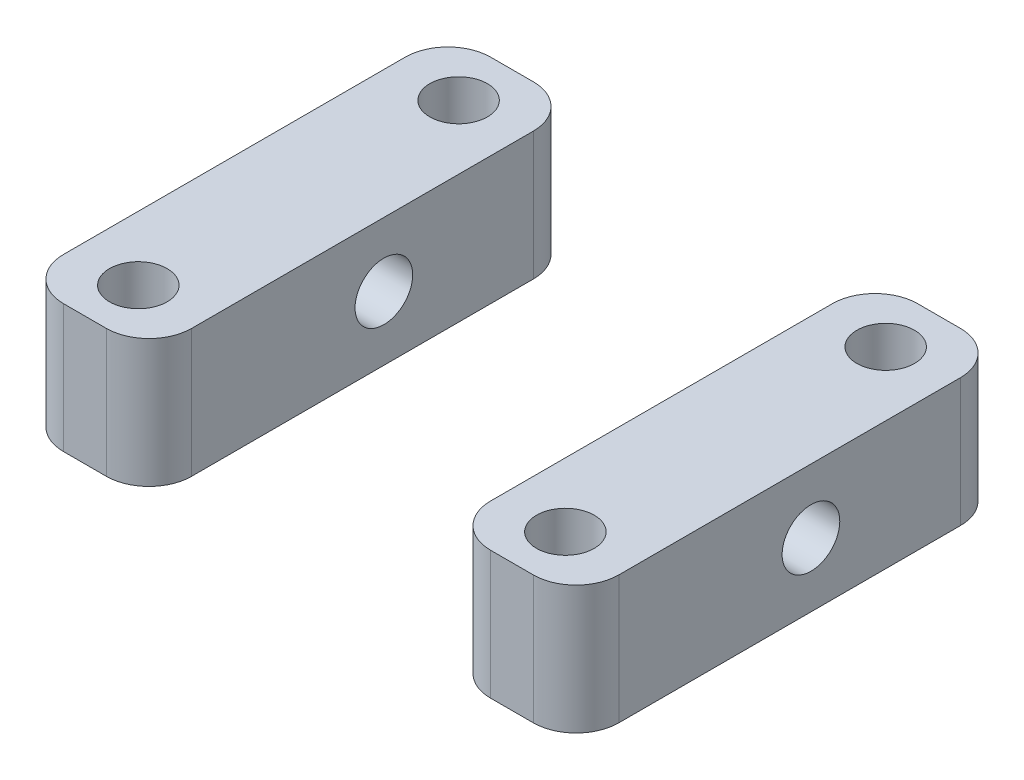
from build123d import *

# Parameters (mm, degrees)
SKETCH_1_W          = 26
SKETCH_1_H          = 20
SKETCH_1_R          = 1.35
EXTRUDE_1_DEPTH     = 6
SKETCH_2_W          = 14
SKETCH_2_H          = 20
CUT_EXTRUDE_1_DEPTH = 18.464249197
SKETCH_5_R          = 1.35
CUT_EXTRUDE_2_DEPTH = 29.495613698
FILLET_1_R          = 2
FILLET_2_R          = 2


with BuildPart() as part:
    # 草图1 → 凸台-拉伸1 (new body)
    with BuildSketch(Plane(origin=(0, 0, 0), x_dir=(1, 0, 0), z_dir=(0, 1, 0))):
        Rectangle(SKETCH_1_W, SKETCH_1_H)
        with Locations(Location((-10, 7.5, 0), (0, 0, 270))):
            Circle(SKETCH_1_R, mode=Mode.SUBTRACT)
        with Locations(Location((10, 7.5, 0), (0, 0, 90))):
            Circle(SKETCH_1_R, mode=Mode.SUBTRACT)
        with Locations(Location((10, -7.5, 0), (0, 0, 270))):
            Circle(SKETCH_1_R, mode=Mode.SUBTRACT)
        with Locations(Location((-10, -7.5, 0), (0, 0, 90))):
            Circle(SKETCH_1_R, mode=Mode.SUBTRACT)
    extrude(amount=EXTRUDE_1_DEPTH)

    # 草图2 → 切除-拉伸1 (cut, through all)
    with BuildSketch(Plane(origin=(0, 6, 0), x_dir=(1, 0, 0), z_dir=(0, 1, 0))):
        Rectangle(SKETCH_2_W, SKETCH_2_H)
    extrude(amount=-CUT_EXTRUDE_1_DEPTH, mode=Mode.SUBTRACT)


with BuildPart() as cut_extrude_1_piece_1:
    # of the separate pieces the step leaves, piece 1, a body of its own (cut_extrude_1_pieces)
    add(part.part.solids().sort_by_distance((7, 0, 10))[0])


with BuildPart() as cut_extrude_1_piece_2:
    # of the separate pieces the step leaves, piece 2, a body of its own (cut_extrude_1_pieces)
    add(part.part.solids().sort_by_distance((-13, 0, 10))[0])


with BuildPart() as cut_extrude_2_tool:
    # 草图5 → 切除-拉伸2 (new, through all)
    with BuildSketch(Plane(origin=(13, 0, 0), x_dir=(0, 0, -1), z_dir=(1, 0, 0))):
        with Locations((1, 3)):
            Circle(SKETCH_5_R)
    extrude(amount=-CUT_EXTRUDE_2_DEPTH)


with BuildPart() as cut_extrude_1_piece_1_1:
    add(cut_extrude_1_piece_1.part)

    # 切除-拉伸2: cut by cut_extrude_2_tool
    add(cut_extrude_2_tool.part, mode=Mode.SUBTRACT)

    # 圆角1
    fillet_1_edges = [cut_extrude_1_piece_1_1.edges().sort_by_distance(p)[0] for p in [
        (7, 3, -10),
        (7, 3, 10),
        (13, 3, 10),
        (13, 3, -10),
    ]]
    fillet(fillet_1_edges, radius=FILLET_1_R)


with BuildPart() as cut_extrude_1_piece_2_1:
    add(cut_extrude_1_piece_2.part)

    # 切除-拉伸2: cut by cut_extrude_2_tool
    add(cut_extrude_2_tool.part, mode=Mode.SUBTRACT)

    # 圆角2
    fillet_2_edges = [cut_extrude_1_piece_2_1.edges().sort_by_distance(p)[0] for p in [
        (-7, 3, 10),
        (-13, 3, 10),
        (-13, 3, -10),
        (-7, 3, -10),
    ]]
    fillet(fillet_2_edges, radius=FILLET_2_R)


solid = Compound([cut_extrude_1_piece_1_1.part, cut_extrude_1_piece_2_1.part])
